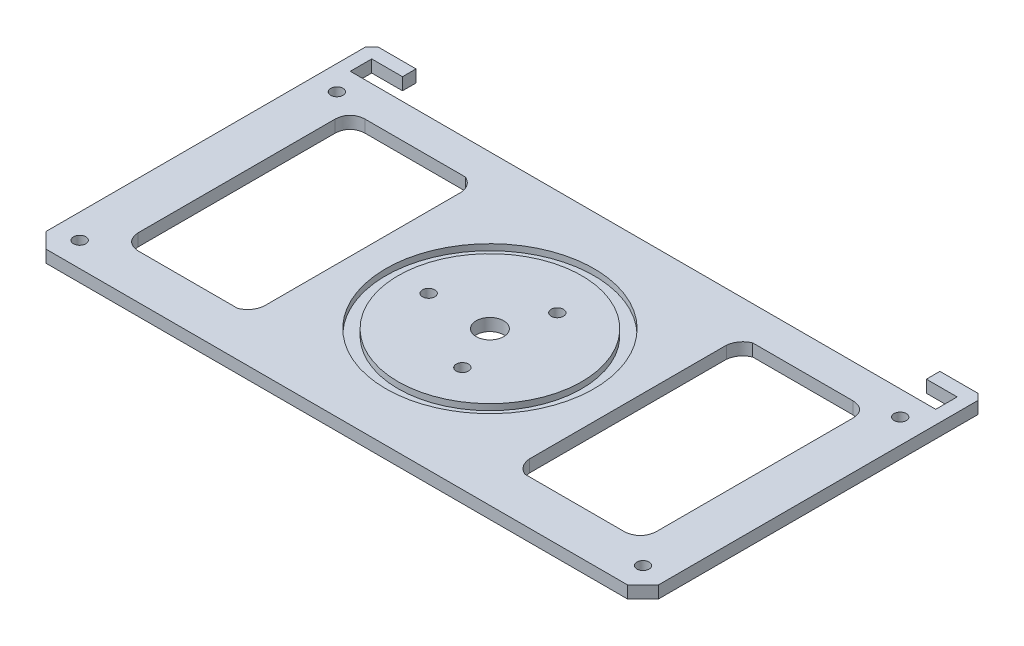
from build123d import *

# Parameters (mm, degrees)
ESQUISSE2_W             = 200
ESQUISSE2_H             = 100
ESQUISSE2_R             = 4.5
ESQUISSE2_R_2           = 2
BOSS_EXTRU_1_DEPTH      = 4
ESQUISSE3_R             = 34
ESQUISSE3_R_2           = 30
ENL_V_MAT_EXTRU_1_DEPTH = 2
ENL_V_MAT_EXTRU_2_DEPTH = 10
BOSS_EXTRU_2_DEPTH      = 4
CHANFREIN1_SIZE         = 5
CHANFREIN2_SIZE         = 2


with BuildPart() as part:
    # Esquisse2 → Boss.-Extru.1 (new body)
    with BuildSketch(Plane(origin=(0, 0, 0), x_dir=(1, 0, 0), z_dir=(0, 1, 0))):
        Rectangle(ESQUISSE2_W, ESQUISSE2_H)
        with Locations(Location((0, 0, 0), (0, 0, 270))):
            Circle(ESQUISSE2_R, mode=Mode.SUBTRACT)
        with Locations(Location((6.5, 15.5, 0), (0, 0, 270))):
            Circle(ESQUISSE2_R_2, mode=Mode.SUBTRACT)
        with Locations(Location((6.5, -15.5, 0), (0, 0, 90))):
            Circle(ESQUISSE2_R_2, mode=Mode.SUBTRACT)
        with Locations(Location((-20, 0, 0), (0, 0, 270))):
            Circle(ESQUISSE2_R_2, mode=Mode.SUBTRACT)
        with Locations(Location((92, 42, 0), (0, 0, 270))):
            Circle(ESQUISSE2_R_2, mode=Mode.SUBTRACT)
        with Locations(Location((-92, 42, 0), (0, 0, 90))):
            Circle(ESQUISSE2_R_2, mode=Mode.SUBTRACT)
        with Locations(Location((-92, -42, 0), (0, 0, 270))):
            Circle(ESQUISSE2_R_2, mode=Mode.SUBTRACT)
        with Locations(Location((92, -42, 0), (0, 0, 90))):
            Circle(ESQUISSE2_R_2, mode=Mode.SUBTRACT)
    extrude(amount=BOSS_EXTRU_1_DEPTH)

    # Esquisse3 → Enlèv. mat.-Extru.1 (cut)
    with BuildSketch(Plane(origin=(0, 4, 0), x_dir=(1, 0, 0), z_dir=(0, 1, 0))):
        with Locations(Location((0, 0, 0), (0, 0, 270))):
            Circle(ESQUISSE3_R)
        with Locations(Location((0, 0, 0), (0, 0, 270))):
            Circle(ESQUISSE3_R_2, mode=Mode.SUBTRACT)
    extrude(amount=-ENL_V_MAT_EXTRU_1_DEPTH, mode=Mode.SUBTRACT)

    # Esquisse4 → Enlèv. mat.-Extru.2 (cut)
    with BuildSketch(Plane(origin=(0, 4, 0), x_dir=(1, 0, 0), z_dir=(0, 1, 0))):
        with BuildLine():
            Line((-84.578253972, 34.018938554), (-84.578253972, -30.428285652))
            add(Edge.make_bspline(
                [(-84.578253972, -30.428285652), (-84.141978558, -34.833934515), (-79.702813843, -35.456083285)],
                knots=[0, 0, 0, 1, 1, 1], degree=2))
            Line((-79.702813843, -35.456083285), (-46.945950476, -35.456083285))
            add(Edge.make_bspline(
                [(-43.289370379, -30.428285652), (-43.697579242, -34.066767069), (-46.945950476, -35.456083285)],
                knots=[0, 0, 0, 1, 1, 1], degree=2))
            Line((-43.289370379, -30.428285652), (-43.289370379, 34.018938554))
            add(Edge.make_bspline(
                [(-46.945950476, 38.894378683), (-43.822752081, 37.558044403), (-43.289370379, 34.018938554)],
                knots=[0, 0, 0, 1, 1, 1], degree=2))
            Line((-46.945950476, 38.894378683), (-79.702813843, 38.894378683))
            add(Edge.make_bspline(
                [(-79.702813843, 38.894378683), (-84.282201555, 38.592094199), (-84.578253972, 34.018938554)],
                knots=[0, 0, 0, 1, 1, 1], degree=2))
        make_face()
        with BuildLine():
            Line((79.702813843, -35.456083285), (46.945950476, -35.456083285))
            add(Edge.make_bspline(
                [(43.289370379, -30.428285652), (43.697579242, -34.066767069), (46.945950476, -35.456083285)],
                knots=[0, 0, 0, 1, 1, 1], degree=2))
            Line((43.289370379, -30.428285652), (43.289370379, 34.018938554))
            add(Edge.make_bspline(
                [(46.945950476, 38.894378683), (43.822752081, 37.558044403), (43.289370379, 34.018938554)],
                knots=[0, 0, 0, 1, 1, 1], degree=2))
            Line((46.945950476, 38.894378683), (79.702813843, 38.894378683))
            add(Edge.make_bspline(
                [(79.702813843, 38.894378683), (84.282201555, 38.592094199), (84.578253972, 34.018938554)],
                knots=[0, 0, 0, 1, 1, 1], degree=2))
            Line((84.578253972, 34.018938554), (84.578253972, -30.428285652))
            add(Edge.make_bspline(
                [(84.578253972, -30.428285652), (84.141978558, -34.833934515), (79.702813843, -35.456083285)],
                knots=[0, 0, 0, 1, 1, 1], degree=2))
        make_face()
    extrude(amount=-ENL_V_MAT_EXTRU_2_DEPTH, mode=Mode.SUBTRACT)

    # Esquisse5 → Boss.-Extru.2 (add)
    with BuildSketch(Plane.XZ):
        Polygon((100, -50), (100, -61.418367617), (85.556933512, -61.418367617), (85.556933512, -57), (95.612528779, -57), (95.612528779, -50), align=None)
    boss_extru_2 = extrude(amount=-BOSS_EXTRU_2_DEPTH)

    # Symétrie1: Boss.-Extru.2 across plane
    add(boss_extru_2.mirror(Plane(origin=(0, 0, 0), x_dir=(0, 0, 1), z_dir=(1, 0, 0))))

    # Chanfrein1
    chanfrein1_edges = [part.edges().sort_by_distance(p)[0] for p in [
        (100, 2, 50),
        (-100, 2, 50),
    ]]
    chamfer(chanfrein1_edges, length=CHANFREIN1_SIZE)

    # Chanfrein2
    chanfrein2_edges = [part.edges().sort_by_distance(p)[0] for p in [
        (100, 2, -61.418367617),
        (-100, 2, -61.418367617),
    ]]
    chamfer(chanfrein2_edges, length=CHANFREIN2_SIZE)


solid = part.part
